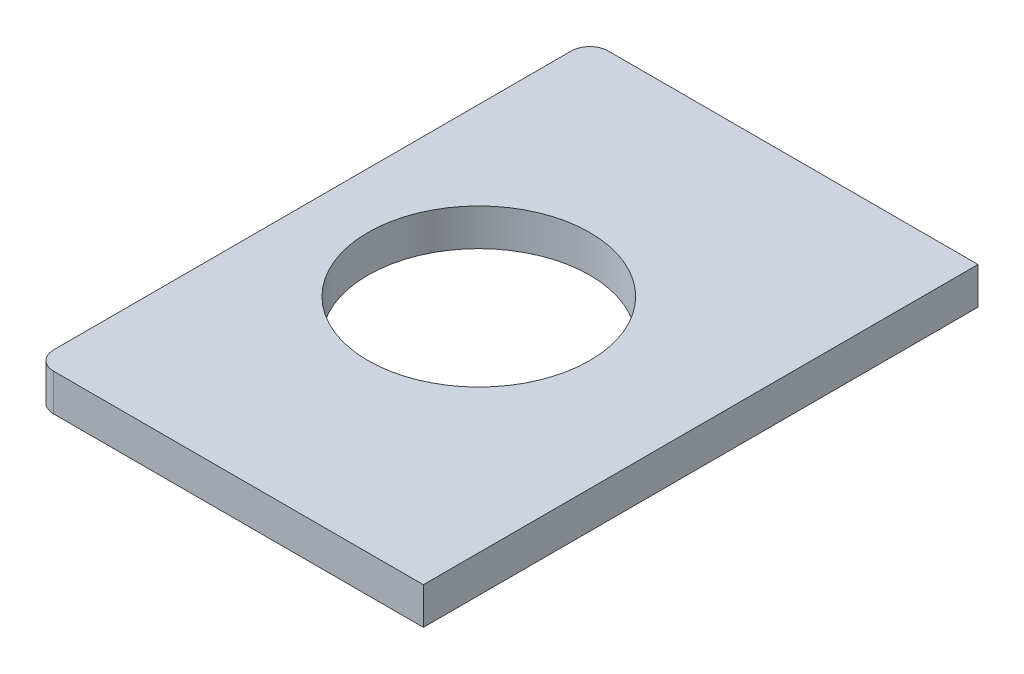
from build123d import *

# Parameters (mm, degrees)
BOSS_EXTRUDE1_DEPTH = 2
FILLET1_R           = 1
SKETCH2_R           = 6
CUT_EXTRUDE1_DEPTH  = 19.418740456


with BuildPart() as part:
    # Sketch1 → Boss-Extrude1 (new body)
    with BuildSketch(Plane(origin=(0, 0, 0), x_dir=(1, 0, 0), z_dir=(0, 1, 0))):
        Polygon((0, -15), (-10.5, -15), (-10.5, 15), (10.5, 15), (10.5, -15), align=None)
    extrude(amount=BOSS_EXTRUDE1_DEPTH)

    # Fillet1
    fillet1_edges = [part.edges().sort_by_distance(p)[0] for p in [
        (-10.5, 1, 15),
        (-10.5, 1, -15),
    ]]
    fillet(fillet1_edges, radius=FILLET1_R)

    # Sketch2 → Cut-Extrude1 (cut, through all)
    with BuildSketch(Plane(origin=(0, 2, 0), x_dir=(1, 0, 0), z_dir=(0, 1, 0))):
        with Locations(Location((-1.5, 0, 0), (0, 0, 270))):
            Circle(SKETCH2_R)
    extrude(amount=-CUT_EXTRUDE1_DEPTH, mode=Mode.SUBTRACT)


solid = part.part
